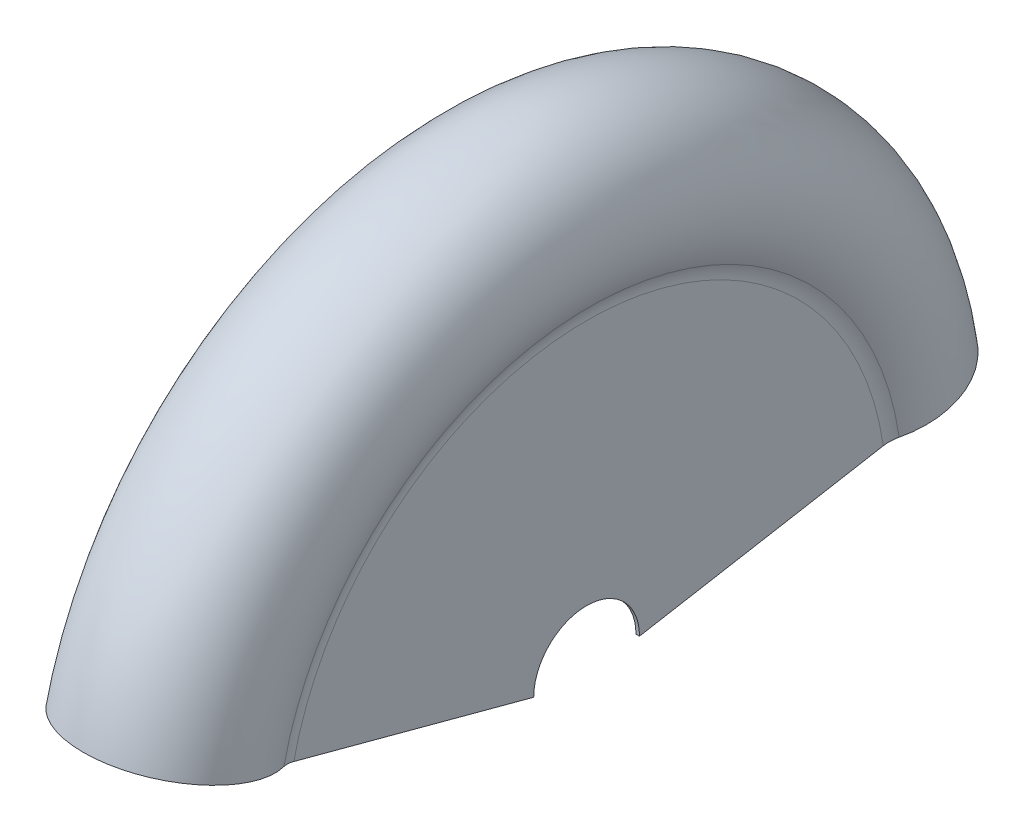
from build123d import *

# Parameters (mm, degrees)
CUT_EXTRUDE1_DEPTH      = 355.271082801
CUT_EXTRUDE1_DEPTH_BACK = 355.271082801
SHELL1_T                = -2


with BuildPart() as part:
    # Sketch1 → Revolve1 (revolve)
    with BuildSketch(Plane.XY, mode=Mode.PRIVATE) as revolve1_sk:
        with BuildLine():
            Line((-44, 0), (44, 0))
            Line((44, 0), (44, 170))
            ThreePointArc((44, 170), (44.406955742, 173.841366627), (45.609756098, 177.512195122))
            ThreePointArc((45.609756098, 177.512195122), (0, 248), (-45.609756098, 177.512195122))
            ThreePointArc((-45.609756098, 177.512195122), (-44.406955742, 173.841366627), (-44, 170))
            Line((-44, 170), (-44, 0))
        make_face()
    revolve(revolve1_sk.sketch.rotate(Axis((-44, 0, 0), (1, 0, 0)), 180), axis=Axis((-44, 0, 0), (1, 0, 0)))

    # Sketch2 → Cut-Extrude1 (cut, two sides: drawn at the far end of the back side and taken through both)
    with BuildSketch(Plane(origin=(0, 0, 0), x_dir=(0, 0, -1), z_dir=(1, 0, 0)).offset(-CUT_EXTRUDE1_DEPTH_BACK)):
        with BuildLine():
            Line((-30, 0), (-289.335468676, 69.4887294))
            Line((-289.335468676, 69.4887294), (-289.335468676, -330.5112706))
            Line((-289.335468676, -330.5112706), (310.664531324, -330.5112706))
            Line((310.664531324, -330.5112706), (310.664531324, 49.4887294))
            Line((310.664531324, 49.4887294), (30, 0))
            ThreePointArc((30, 0), (0, 30), (-30, 0))
        make_face()
    extrude(amount=CUT_EXTRUDE1_DEPTH + CUT_EXTRUDE1_DEPTH_BACK, mode=Mode.SUBTRACT)

    # Shell1
    shell1_openings = [part.faces().sort_by_distance(p)[0] for p in [
        (1.12e-07, 18.550551002, -135.20540264),
        (-1.736e-06, 27.714135748, 133.430562698),
        (0, 30, 0),
    ]]
    offset(amount=SHELL1_T, openings=shell1_openings, kind=Kind.INTERSECTION)


solid = part.part
